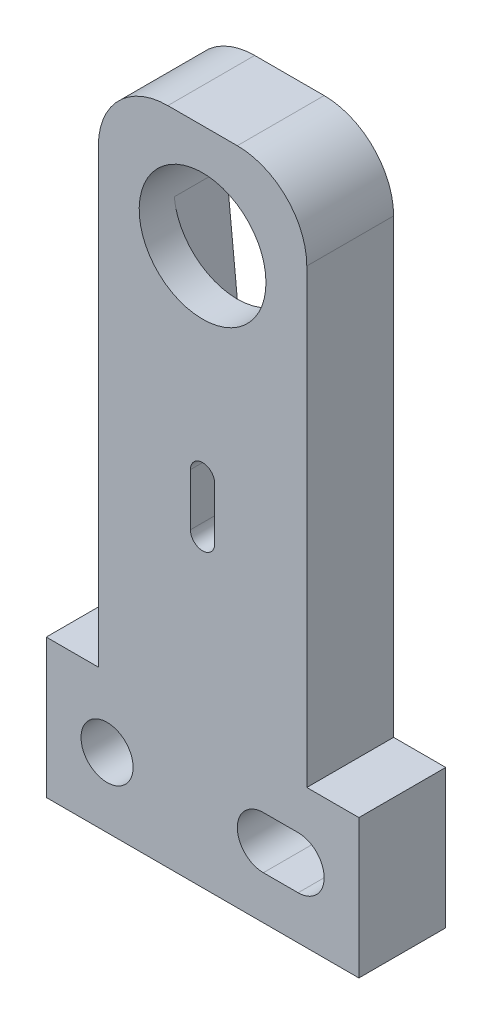
from build123d import *

# Parameters (mm, degrees)
ESBO_O1_R                = 1.5
ESBO_O1_R_2              = 3.65
RESSALTO_EXTRUS_O1_DEPTH = 5
CORTE_EXTRUS_O1_DEPTH    = 3


with BuildPart() as part:
    # Esboço1 → Ressalto-extrusão1 (new body)
    with BuildSketch(Plane.XY):
        with BuildLine():
            ThreePointArc((-2, 6), (-4.828427125, 4.828427125), (-6, 2))
            Line((-6, 2), (-6, -24))
            Line((-6, -24), (-9, -24))
            Line((-9, -24), (-9, -32))
            Line((-9, -32), (9, -32))
            Line((9, -32), (9, -24))
            Line((9, -24), (6, -24))
            Line((6, -24), (6, 2))
            ThreePointArc((6, 2), (4.828427125, 4.828427125), (2, 6))
            Line((2, 6), (-2, 6))
        make_face()
        with Locations((-5.5, -28)):
            Circle(ESBO_O1_R, mode=Mode.SUBTRACT)
        with BuildLine():
            Line((3.5, -26.5), (5.5, -26.5))
            ThreePointArc((5.5, -26.5), (7, -28), (5.5, -29.5))
            Line((5.5, -29.5), (3.5, -29.5))
            ThreePointArc((3.5, -29.5), (2, -28), (3.5, -26.5))
        make_face(mode=Mode.SUBTRACT)
        Circle(ESBO_O1_R_2, mode=Mode.SUBTRACT)
        with BuildLine():
            Line((0.7, -11.5), (0.7, -14.5))
            ThreePointArc((0.7, -14.5), (0, -15.2), (-0.7, -14.5))
            Line((-0.7, -14.5), (-0.7, -11.5))
            ThreePointArc((-0.7, -11.5), (0, -10.8), (0.7, -11.5))
        make_face(mode=Mode.SUBTRACT)
    extrude(amount=RESSALTO_EXTRUS_O1_DEPTH)

    # Esboço1<3> → Corte-extrusão1 (cut)
    with BuildSketch(Plane.XY):
        with BuildLine():
            ThreePointArc((-2.238721733, -14.225), (0, -16.25), (2.238721733, -14.225))
            Line((2.238721733, -14.225), (3.631704145, -0.365))
            ThreePointArc((3.631704145, -0.365), (0, -3.65), (-3.631704145, -0.365))
            Line((-3.631704145, -0.365), (-2.238721733, -14.225))
        make_face()
        with BuildLine():
            ThreePointArc((0.7, -14.5), (0, -15.2), (-0.7, -14.5))
            Line((-0.7, -14.5), (-0.7, -11.5))
            ThreePointArc((-0.7, -11.5), (0, -10.8), (0.7, -11.5))
            Line((0.7, -11.5), (0.7, -14.5))
        make_face(mode=Mode.SUBTRACT)
    extrude(amount=CORTE_EXTRUS_O1_DEPTH, mode=Mode.SUBTRACT)


solid = part.part
